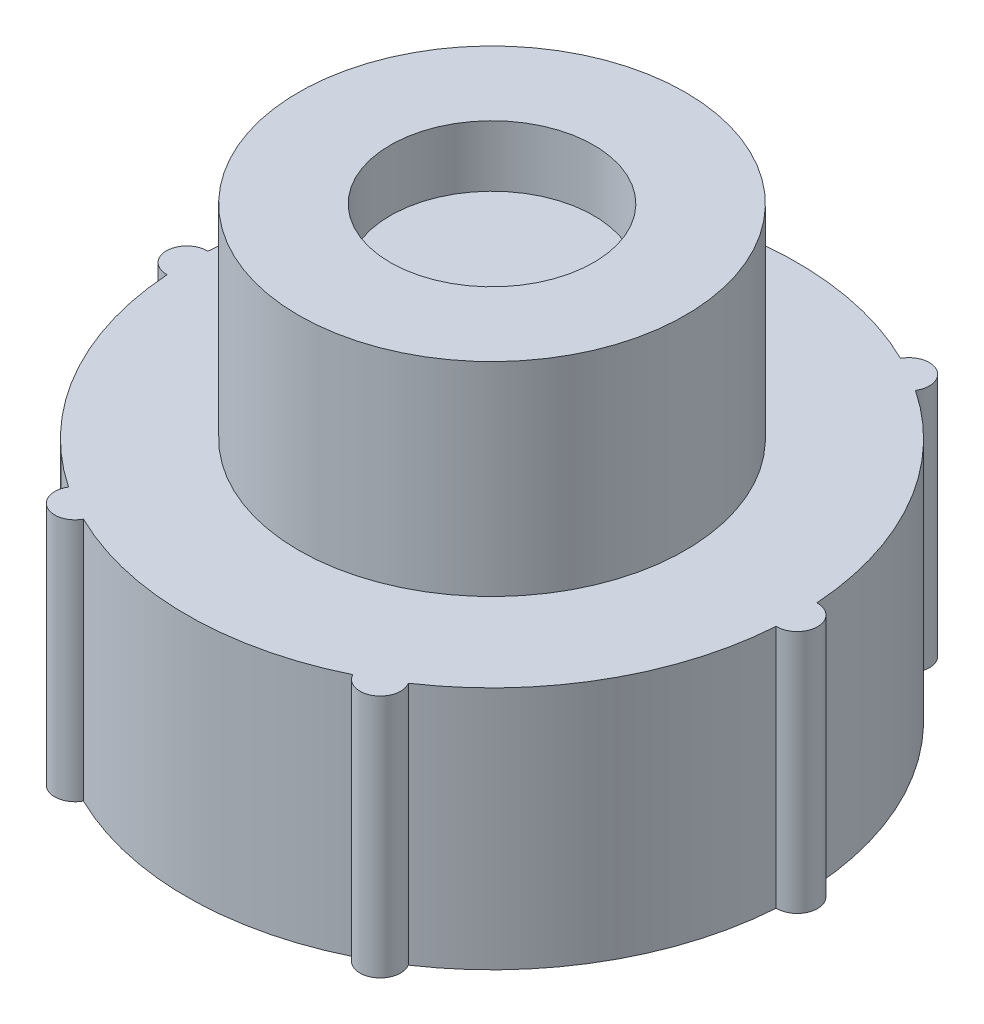
from build123d import *

# Parameters (mm, degrees)
SKETCH1_R           = 15
BOSS_EXTRUDE1_DEPTH = 12
SKETCH2_R           = 9.5
BOSS_EXTRUDE2_DEPTH = 10
SKETCH3_R           = 5
CUT_EXTRUDE1_DEPTH  = 3
SKETCH4_R           = 1
BOSS_EXTRUDE3_DEPTH = 12


with BuildPart() as part:
    # Sketch1 → Boss-Extrude1 (new body)
    with BuildSketch(Plane(origin=(0, 0, 0), x_dir=(1, 0, 0), z_dir=(0, 1, 0))):
        with Locations(Location((0, 0, 0), (0, 0, 270))):
            Circle(SKETCH1_R)
    extrude(amount=BOSS_EXTRUDE1_DEPTH)

    # Sketch2 → Boss-Extrude2 (add)
    with BuildSketch(Plane(origin=(0, 12, 0), x_dir=(1, 0, 0), z_dir=(0, 1, 0))):
        with Locations(Location((0, 0, 0), (0, 0, 270))):
            Circle(SKETCH2_R)
    extrude(amount=BOSS_EXTRUDE2_DEPTH)

    # Sketch3 → Cut-Extrude1 (cut)
    with BuildSketch(Plane(origin=(0, 22, 0), x_dir=(1, 0, 0), z_dir=(0, 1, 0))):
        with Locations(Location((0, 0, 0), (0, 0, 270))):
            Circle(SKETCH3_R)
    extrude(amount=-CUT_EXTRUDE1_DEPTH, mode=Mode.SUBTRACT)

    # Sketch4 → Boss-Extrude3 (add)
    with BuildSketch(Plane.XZ):
        with Locations((15, 0)):
            Circle(SKETCH4_R)
        with Locations((7.5, -12.990381057)):
            Circle(SKETCH4_R)
        with Locations((-7.5, -12.990381057)):
            Circle(SKETCH4_R)
        with Locations((-15, 0)):
            Circle(SKETCH4_R)
        with Locations((-7.5, 12.990381057)):
            Circle(SKETCH4_R)
        with Locations((7.5, 12.990381057)):
            Circle(SKETCH4_R)
    extrude(amount=-BOSS_EXTRUDE3_DEPTH)


solid = part.part
